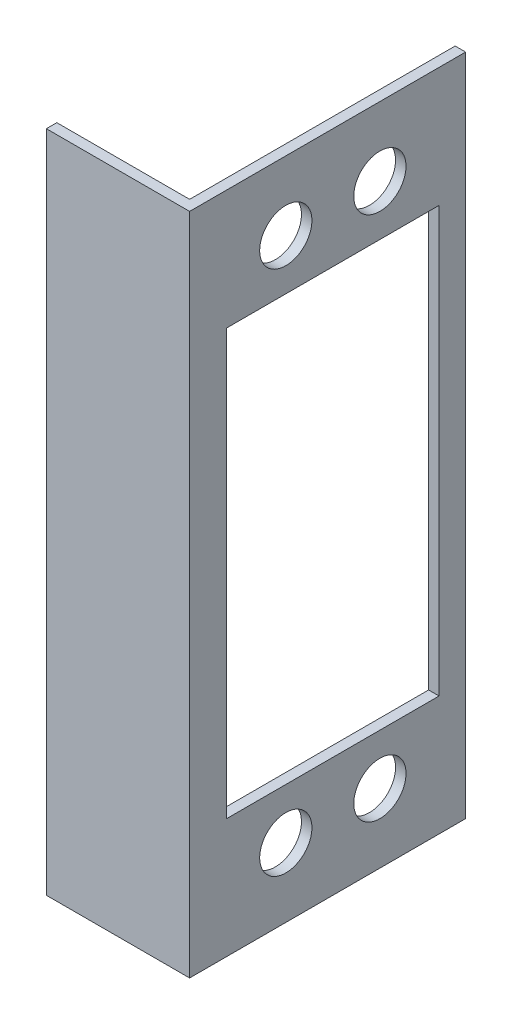
from build123d import *

# Parameters (mm, degrees)
SKETCH1_W             = 1
SKETCH1_H             = 25.4
SKETCH1_W_2           = 13.7
SKETCH1_H_2           = 1
BOSS_EXTRUDE1_DEPTH   = 63.5
SKETCH2_W             = 20.32
SKETCH2_H             = 40.64
CUT_EXTRUDE1_DEPTH    = 70.932109935
F_5_0MM_DOWEL_HOLE1_D = 5


with BuildPart() as part:
    # Sketch1 → Boss-Extrude1 (new body)
    with BuildSketch(Plane(origin=(0, 0, 0), x_dir=(1, 0, 0), z_dir=(0, 1, 0))):
        with Locations((13.2, 13.7)):
            Rectangle(SKETCH1_W, SKETCH1_H)
        with Locations((6.85, 0.5)):
            Rectangle(SKETCH1_W_2, SKETCH1_H_2)
    extrude(amount=BOSS_EXTRUDE1_DEPTH)

    # Sketch2 → Cut-Extrude1 (cut, through all)
    with BuildSketch(Plane.ZY.offset(-12.7)):
        with Locations((-13.7, 31.75)):
            Rectangle(SKETCH2_W, SKETCH2_H)
    extrude(amount=-CUT_EXTRUDE1_DEPTH, mode=Mode.SUBTRACT)

    # Ø5.0mm Dowel Hole1 (through all)
    with Locations(Plane.ZY.offset(-12.7)):
        with Locations((-9.2, 6.6), (-18.2, 56.9), (-9.2, 56.9), (-18.2, 6.6)):
            Hole(F_5_0MM_DOWEL_HOLE1_D / 2)


solid = part.part
